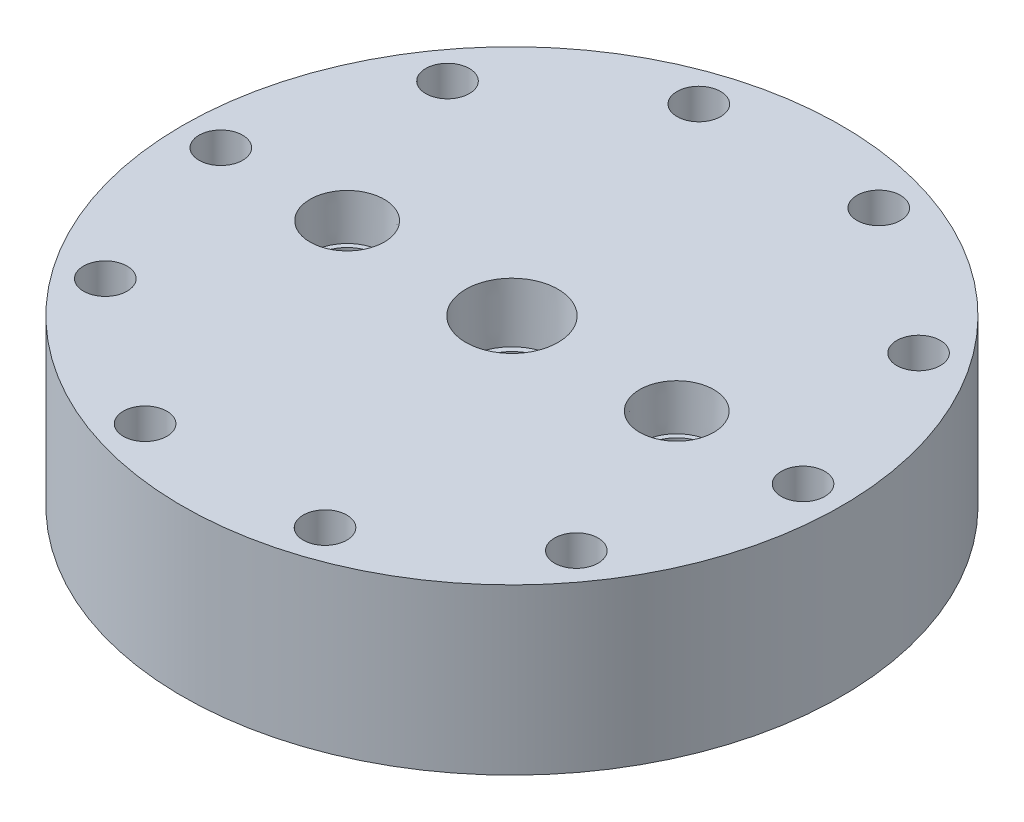
from build123d import *

# Parameters (mm, degrees)
F_3_8_NPT_TAPPED_HOLE1_AT_2_COUNT = 2
F_3_8_NPT_TAPPED_HOLE1_AT_2_PITCH = 76.2
F_3_8_CLEARANCE_HOLE2_D           = 10.0838
CIRPATTERN1_COUNT                 = 10
SKETCH18_R                        = 1.27
CUT_EXTRUDE2_DEPTH                = 3.302


with BuildPart() as part:
    # Sketch1 → Revolve1 (revolve)
    with BuildSketch(Plane.XY):
        Polygon((0, 0), (-76.2, 0), (-76.2, -38.1), (-60.96, -38.1), (-60.96, -32.258), (-55.7149, -32.258), (-55.7149, -29.5656), (-51.6509, -29.5656), (-51.6509, -32.258), (-28.575, -32.258), (-28.575, -27.178), (-28.0924, -27.178), (-28.0924, -24.4856), (-24.0284, -24.4856), (-24.0284, -27.178), (-22.225, -27.178), (0, -15.85722), align=None)
    revolve(axis=Axis((0, 0, 0), (0, -1, 0)))

    # Sketch3 → 1/2 NPT Tapped Hole1 (revolve, cut)
    with BuildSketch(Plane(origin=(0, 0, 0), x_dir=(0, 0, 1), z_dir=(1, 0, 0))):
        Polygon((0, 0), (0, 38.1), (8.9281, 38.1), (8.9281, 13.462), (10.261665792, 13.462), (10.6647361, 0), align=None)
    revolve(axis=Axis((0, 6.35, 0), (0, -1, 0)), mode=Mode.SUBTRACT)

    # Sketch5 → 3/8 NPT Tapped Hole1 (revolve, cut)
    with BuildSketch(Plane(origin=(-38.1, 0, 0), x_dir=(0, 0, 1), z_dir=(1, 0, 0))):
        Polygon((0, 0), (0, 38.1), (7.1374, 38.1), (7.1374, 10.414), (8.263205494, 10.414), (8.5750146, 0), align=None)
    f_3_8_npt_tapped_hole1 = revolve(axis=Axis((-38.1, 6.35, 0), (0, -1, 0)), mode=Mode.SUBTRACT)

    # 3/8 NPT Tapped Hole1 at 2: 3/8 NPT Tapped Hole1 ×2
    with Locations(*[(i * F_3_8_NPT_TAPPED_HOLE1_AT_2_PITCH, 0, 0) for i in range(1, F_3_8_NPT_TAPPED_HOLE1_AT_2_COUNT)]):
        add(f_3_8_npt_tapped_hole1, mode=Mode.SUBTRACT)

    # 3/8 Clearance Hole2 (through all)
    with Locations(Plane(origin=(67.31, 0, 0), x_dir=(1, 0, 0), z_dir=(0, 1, 0))):
        with Locations((0, 0)):
            f_3_8_clearance_hole2 = Hole(F_3_8_CLEARANCE_HOLE2_D / 2)

    # CirPattern1: 3/8 Clearance Hole2 ×10 about axis
    cirpattern1_axis = Axis((0, 0, 0), (0, 1, 0))
    for i in range(1, CIRPATTERN1_COUNT):
        add(f_3_8_clearance_hole2.rotate(cirpattern1_axis, i * 360 / CIRPATTERN1_COUNT), mode=Mode.SUBTRACT)

    # Sketch18 → Cut-Extrude2 (cut)
    with BuildSketch(Plane.XZ.offset(32.258)):
        with Locations((0, 44.45)):
            Circle(SKETCH18_R)
        with Locations((0, -44.45)):
            Circle(SKETCH18_R)
    extrude(amount=-CUT_EXTRUDE2_DEPTH, mode=Mode.SUBTRACT)


solid = part.part
